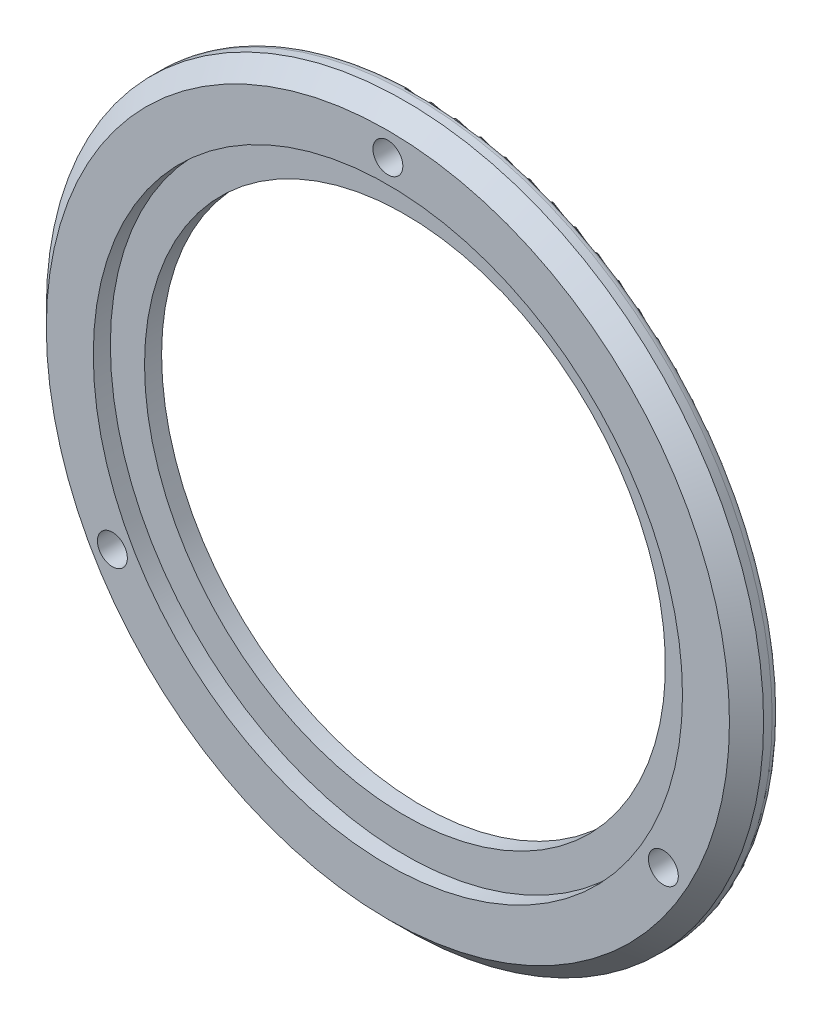
from build123d import *

# Parameters (mm, degrees)
SKETCH_1_R          = 42
SKETCH_1_R_2        = 30.5
EXTRUDE_1_DEPTH     = 4
CHAMFER_1_SIZE      = 2
SKETCH_3_R          = 34.5
CUT_EXTRUDE_2_DEPTH = 2
SKETCH_4_R          = 1.75
CUT_EXTRUDE_5_DEPTH = 60.531504265
FILLET_2_R          = 1


with BuildPart() as part:
    # Эскиз1 → Бобышка-Вытянуть1 (new body)
    with BuildSketch(Plane.XY):
        Circle(SKETCH_1_R)
        Circle(SKETCH_1_R_2, mode=Mode.SUBTRACT)
    extrude(amount=EXTRUDE_1_DEPTH)

    # Фаска1
    chamfer_1_edges = [part.edges().sort_by_distance(p)[0] for p in [
        (-42, 0, 4),
    ]]
    chamfer(chamfer_1_edges, length=CHAMFER_1_SIZE)

    # Эскиз3 → Вырез-Вытянуть2 (cut)
    with BuildSketch(Plane.XY.offset(4)):
        Circle(SKETCH_3_R)
    extrude(amount=-CUT_EXTRUDE_2_DEPTH, mode=Mode.SUBTRACT)

    # Эскиз4 → Вырез-Вытянуть5 (cut, through all)
    with BuildSketch(Plane.XY.offset(4)):
        with Locations((0, 37.25)):
            Circle(SKETCH_4_R)
        with Locations((32.259446291, -18.625)):
            Circle(SKETCH_4_R)
        with Locations((-32.259446291, -18.625)):
            Circle(SKETCH_4_R)
    extrude(amount=-CUT_EXTRUDE_5_DEPTH, mode=Mode.SUBTRACT)

    # Скругление2
    fillet_2_edges = [part.edges().sort_by_distance(p)[0] for p in [
        (-42, 0, 0),
    ]]
    fillet(fillet_2_edges, radius=FILLET_2_R)


solid = part.part
